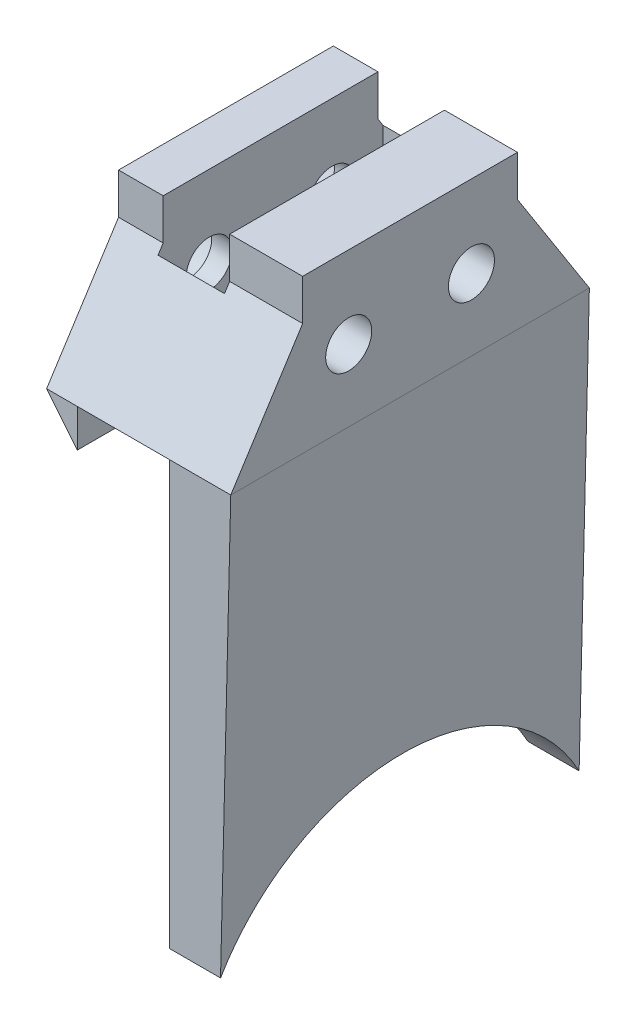
from build123d import *

# Parameters (mm, degrees)
GRIPPER_ATTACHMENT_BASE_SKETCH_W   = 12
GRIPPER_ATTACHMENT_BASE_SKETCH_H   = 15
GRIPPER_ATTACHMENT_BASE_DEPTH      = 35.0588586
THICKENER_BASE_DEPTH               = 6
THICKNESS_CUTOFF_SKETCH_W          = 51.475312709
THICKNESS_CUTOFF_SKETCH_H          = 66.937611181
THICKNESS_CUTOFF_DEPTH             = 63.622352222
EXCESS_MATERIAL_CUTOFF_DEPTH       = 530.479784495
EXCESS_MATERIAL_CUTOFF_DEPTH_BACK  = 530.479784495
FINGER_CAVITY_CUTOUT_SKETCH_W      = 6.5
FINGER_CAVITY_CUTOUT_SKETCH_H      = 22
FINGER_CAVITY_CUTOUT_DEPTH         = 15
SCREW_THROUGH_HOLES_SKETCH_R       = 2.25
SCREW_THROUGH_HOLES_DEPTH          = 63.800756824
SOCKET_RECESSES_SKETCH_R           = 3.75
SOCKET_RECESSES_DEPTH              = 2.3625
SHAPING_TO_ELECTRONICS_PLATE_DEPTH = 35.058859


with BuildPart() as part:
    # Gripper Attachment Base Sketch → Gripper Attachment Base (new body)
    with BuildSketch(Plane.XY):
        Rectangle(GRIPPER_ATTACHMENT_BASE_SKETCH_W, GRIPPER_ATTACHMENT_BASE_SKETCH_H)
    extrude(amount=GRIPPER_ATTACHMENT_BASE_DEPTH)

    # Thickener Base Sketch → Thickener Base (add)
    with BuildSketch(Plane(origin=(6, 0, 0), x_dir=(0, 0, -1), z_dir=(1, 0, 0))):
        with BuildLine():
            Line((0, 7.5), (-35.0588586, 7.5))
            Line((-35.0588586, 7.5), (-35.0588586, -48.8959251))
            ThreePointArc((-35.0588586, -48.8959251), (-17.5294293, -38.525001297), (0, -48.8959251))
            Line((0, -48.8959251), (0, 7.5))
        make_face()
    extrude(amount=THICKENER_BASE_DEPTH)

    # Thickness Cutoff Sketch → Thickness Cutoff (cut, through all)
    with BuildSketch(Plane(origin=(12.174072963, -0.29408868, 0), x_dir=(0, 0, -1), z_dir=(0.9997083481115524, -0.02414992165766464, 0))):
        with Locations((-17.603923241, -21.483184787)):
            Rectangle(THICKNESS_CUTOFF_SKETCH_W, THICKNESS_CUTOFF_SKETCH_H)
    extrude(amount=THICKNESS_CUTOFF_DEPTH, mode=Mode.SUBTRACT)

    # Excess Material Cutoff Sketch → Excess Material Cutoff (cut, two sides: drawn at the far end of the back side and taken through both)
    with BuildSketch(Plane(origin=(0, -520.681520523, 0), x_dir=(0, 0, 1), z_dir=(1, 0, 0)).offset(-EXCESS_MATERIAL_CUTOFF_DEPTH_BACK)):
        Polygon((7.0294293, -528.181520523), (0, -528.181520523), (0, -513.181520523), (7.0294293, -524.181520523), align=None)
        Polygon((28.0294293, -528.181520523), (35.0588586, -528.181520523), (35.0588586, -513.181520523), (28.0294293, -524.181520523), align=None)
    extrude(amount=EXCESS_MATERIAL_CUTOFF_DEPTH + EXCESS_MATERIAL_CUTOFF_DEPTH_BACK, mode=Mode.SUBTRACT)

    # Finger Cavity Cutout Sketch → Finger Cavity Cutout (cut)
    with BuildSketch(Plane(origin=(0, 7.5, 0), x_dir=(1, 0, 0), z_dir=(0, 1, 0))):
        with Locations((1.6125, -17.5294293)):
            Rectangle(FINGER_CAVITY_CUTOUT_SKETCH_W, FINGER_CAVITY_CUTOUT_SKETCH_H)
    extrude(amount=-FINGER_CAVITY_CUTOUT_DEPTH, mode=Mode.SUBTRACT)

    # Screw Through-Holes Sketch → Screw Through-Holes (cut, through all)
    with BuildSketch(Plane.ZY.offset(6)):
        with Locations(Location((11.5294293, -0.5, 0), (0, 0, 270))):
            Circle(SCREW_THROUGH_HOLES_SKETCH_R)
        with Locations(Location((23.5294293, -0.5, 0), (0, 0, 270))):
            Circle(SCREW_THROUGH_HOLES_SKETCH_R)
    extrude(amount=-SCREW_THROUGH_HOLES_DEPTH, mode=Mode.SUBTRACT)

    # Socket Recesses Sketch → Socket Recesses (cut)
    with BuildSketch(Plane.ZY.offset(6)):
        with Locations(Location((11.5294293, -0.5, 0), (0, 0, 270))):
            Circle(SOCKET_RECESSES_SKETCH_R)
        with Locations(Location((23.5294293, -0.5, 0), (0, 0, 270))):
            Circle(SOCKET_RECESSES_SKETCH_R)
    extrude(amount=-SOCKET_RECESSES_DEPTH, mode=Mode.SUBTRACT)

    # Shaping to Electronics Plate Sketch → Shaping to Electronics Plate (add, through all)
    with BuildSketch(Plane.XY):
        Polygon((-6, -7.5), (-3, -11.2), (-3, -7.5), align=None)
    extrude(amount=SHAPING_TO_ELECTRONICS_PLATE_DEPTH)


solid = part.part
